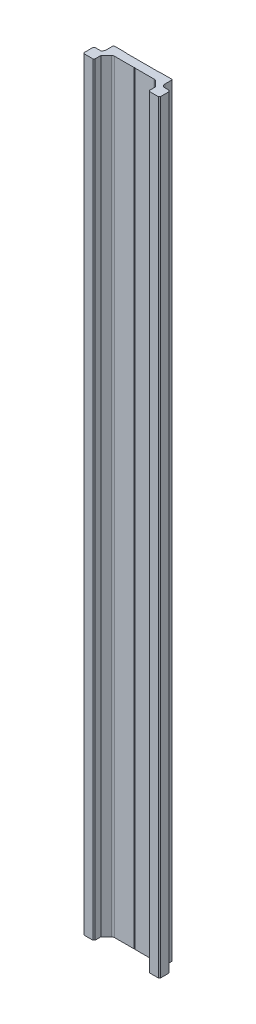
from build123d import *

# Parameters (mm, degrees)
BOSS_EXTRUDE1_DEPTH = 350


with BuildPart() as part:
    # Sketch1 → Boss-Extrude1 (new body)
    with BuildSketch(Plane(origin=(0, 200, 0), x_dir=(1, 0, 0), z_dir=(0, 1, 0))):
        with BuildLine():
            Line((1e-09, -3.855700002), (0.25, -4.00003757))
            Line((0.25, -4.00003757), (9.078700232, -4.00003757))
            ThreePointArc((9.078700232, -4.00003757), (9.652725366, -4.114218268), (10.139360377, -4.439377387))
            Line((10.139360377, -4.439377387), (12.500020747, -6.800037757))
            Line((12.500020747, -6.800037757), (12.500020747, -9.500037757))
            Line((12.500020747, -9.500037757), (13.00002072, -10.000037755))
            Line((13.00002072, -10.000037755), (17.00002072, -10.000037755))
            Line((17.00002072, -10.000037755), (17.500020747, -9.500037752))
            Line((17.500020747, -9.500037752), (17.500020747, -5.500037752))
            Line((17.500020747, -5.500037752), (17.00002075, -5.0000377))
            Line((17.00002075, -5.0000377), (14.30002072, -5.0000377))
            Line((14.30002072, -5.0000377), (14.085807141, -4.785824121))
            ThreePointArc((14.085807141, -4.785824121), (13.652261651, -4.136977442), (13.50002072, -3.371610598))
            Line((13.50002072, -3.371610598), (13.50002072, -0.30003757))
            Line((13.50002072, -0.30003757), (13.20002072, -3.757e-05))
            Line((13.20002072, -3.757e-05), (7.50002072, -3.757e-05))
            Line((7.50002072, -3.757e-05), (7.40002072, -0.10003757))
            Line((7.40002072, -0.10003757), (-7.40002072, -0.10003757))
            Line((-7.40002072, -0.10003757), (-7.50002072, -3.757e-05))
            Line((-7.50002072, -3.757e-05), (-13.20002072, -3.757e-05))
            Line((-13.20002072, -3.757e-05), (-13.50002072, -0.30003757))
            Line((-13.50002072, -0.30003757), (-13.50002072, -3.371610628))
            ThreePointArc((-13.50002072, -3.371610628), (-13.652261651, -4.136977472), (-14.085807141, -4.785824151))
            Line((-14.085807141, -4.785824151), (-14.30002069, -5.0000377))
            Line((-14.30002069, -5.0000377), (-17.00002072, -5.0000377))
            Line((-17.00002072, -5.0000377), (-17.50002072, -5.50003767))
            Line((-17.50002072, -5.50003767), (-17.50002072, -9.50003767))
            Line((-17.50002072, -9.50003767), (-17.000020665, -10.000037755))
            Line((-17.000020665, -10.000037755), (-13.00002072, -10.000037755))
            Line((-13.00002072, -10.000037755), (-12.500020741, -9.500037764))
            Line((-12.500020741, -9.500037764), (-12.500020741, -6.800037764))
            Line((-12.500020741, -6.800037764), (-10.139360364, -4.439377387))
            ThreePointArc((-10.139360364, -4.439377387), (-9.652725352, -4.114218268), (-9.078700218, -4.00003757))
            Line((-9.078700218, -4.00003757), (-0.25, -4.00003757))
            Line((-0.25, -4.00003757), (1e-09, -3.855700002))
        make_face()
    extrude(amount=-BOSS_EXTRUDE1_DEPTH)


solid = part.part
